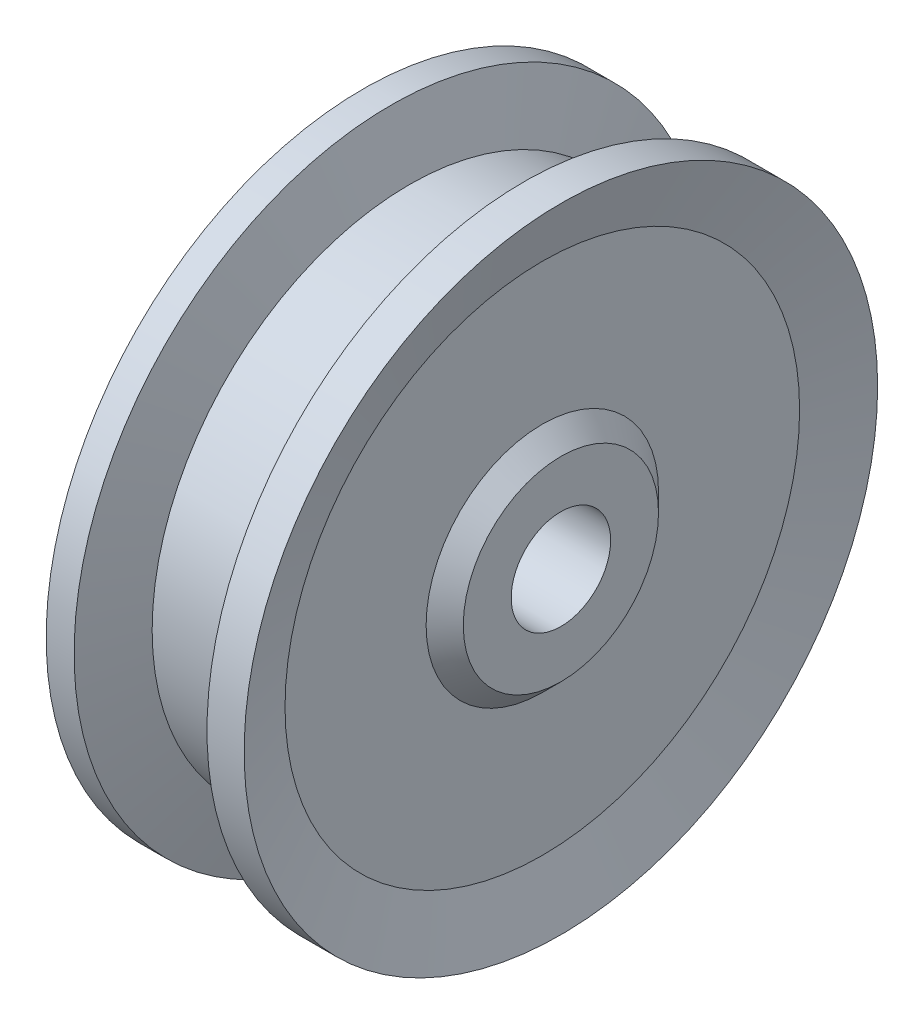
from build123d import *


with BuildPart() as part:
    # Croquis1 → Revolución1 (revolve)
    with BuildSketch(Plane.XY, mode=Mode.PRIVATE) as revoluci_n1_sk:
        Polygon((-12.5, 6.280814534), (12.5, 6.280814534), (12.5, 12.32741192), (10.153373727, 14.674038193), (10.153373727, 32.490795926), (12.5, 40), (7.806747454, 40), (5.46012118, 32.490795926), (-6.627065662, 32.490795926), (-8.973691936, 40), (-12.5, 40), (-10.153373727, 32.490795926), (-10.153373727, 14.674038193), (-12.5, 12.32741192), align=None)
    revolve(revoluci_n1_sk.sketch.rotate(Axis((57.676848905, 0, 0), (-1, 0, 0)), 90), axis=Axis((57.676848905, 0, 0), (-1, 0, 0)))


solid = part.part
